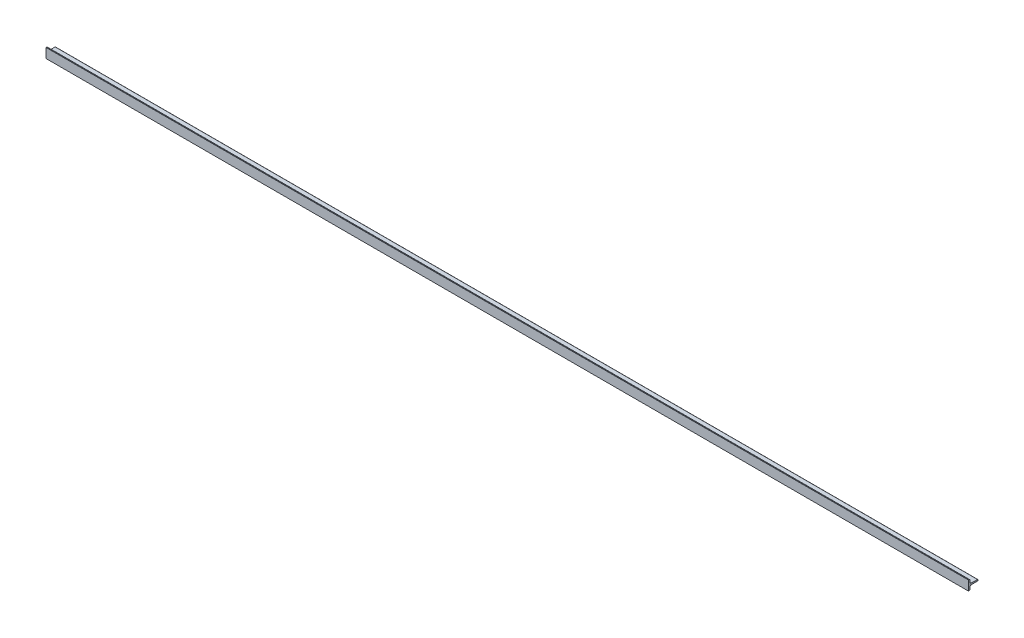
from build123d import *

# Parameters (mm, degrees)
T_SECTION_T_20_X_20_1_DEPTH = 1920


with BuildPart() as part:
    # Sketch12 → T section T 20 X 20(1) (new body)
    with BuildSketch(Plane.YZ):
        with BuildLine():
            Line((-10, 20), (10, 20))
            Line((10, 20), (10, 18.570314587))
            ThreePointArc((10, 18.570314587), (9.571214338, 17.520314662), (8.530000209, 17.070614622))
            Line((8.530000209, 17.070614622), (4.520436432, 16.990406743))
            ThreePointArc((4.520436432, 16.990406743), (2.459116507, 16.112327155), (1.581036919, 14.05100723))
            Line((1.581036919, 14.05100723), (1.319562646, 0.97999986))
            ThreePointArc((1.319562646, 0.97999986), (1.019762619, 0.285857108), (0.319762669, 0))
            Line((0.319762669, 0), (-0.319762669, 0))
            ThreePointArc((-0.319762669, 0), (-1.019762619, 0.285857108), (-1.319562646, 0.97999986))
            Line((-1.319562646, 0.97999986), (-1.581036919, 14.05100723))
            ThreePointArc((-1.581036919, 14.05100723), (-2.459116507, 16.112327155), (-4.520436432, 16.990406743))
            Line((-4.520436432, 16.990406743), (-8.530000209, 17.070614622))
            ThreePointArc((-8.530000209, 17.070614622), (-9.571214338, 17.520314662), (-10, 18.570314587))
            Line((-10, 18.570314587), (-10, 20))
        make_face()
    extrude(amount=T_SECTION_T_20_X_20_1_DEPTH)


solid = part.part
